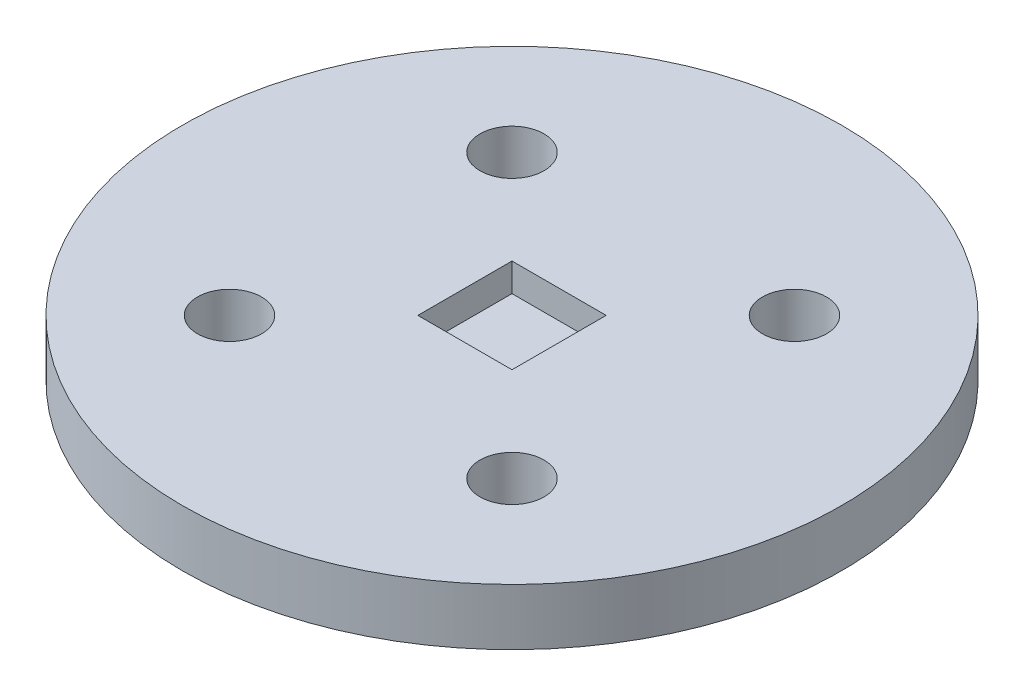
from build123d import *

# Parameters (mm, degrees)
SKETCH1_R           = 35
BOSS_EXTRUDE1_DEPTH = 6
SKETCH11_W          = 10
SKETCH11_H          = 10
CUT_EXTRUDE3_DEPTH  = 3
SKETCH12_R          = 3.4
CUT_EXTRUDE4_DEPTH  = 50.859803449
SKETCH6_W           = 6.2
SKETCH6_H           = 6.2
CUT_EXTRUDE6_DEPTH  = 1.5


with BuildPart() as part:
    # Sketch1 → Boss-Extrude1 (new body)
    with BuildSketch(Plane(origin=(0, 0, 0), x_dir=(1, 0, 0), z_dir=(0, 1, 0))):
        with Locations(Location((0, 0, 0), (0, 0, 270))):
            Circle(SKETCH1_R)
    extrude(amount=BOSS_EXTRUDE1_DEPTH)

    # Sketch11 → Cut-Extrude3 (cut)
    with BuildSketch(Plane(origin=(0, 6, 0), x_dir=(1, 0, 0), z_dir=(0, 1, 0))):
        Rectangle(SKETCH11_W, SKETCH11_H)
    extrude(amount=-CUT_EXTRUDE3_DEPTH, mode=Mode.SUBTRACT)

    # Sketch12 → Cut-Extrude4 (cut, through all)
    with BuildSketch(Plane.XZ):
        with Locations(Location((15, -15, 0), (0, 0, 270))):
            Circle(SKETCH12_R)
        with Locations(Location((-15, -15, 0), (0, 0, 270))):
            Circle(SKETCH12_R)
        with Locations(Location((15, 15, 0), (0, 0, 270))):
            Circle(SKETCH12_R)
        with Locations(Location((-15, 15, 0), (0, 0, 270))):
            Circle(SKETCH12_R)
    extrude(amount=-CUT_EXTRUDE4_DEPTH, mode=Mode.SUBTRACT)

    # Sketch6 → Cut-Extrude6 (cut)
    with BuildSketch(Plane(origin=(0, 0, -4.132474232), x_dir=(1, 0, 0), z_dir=(0, -1, 0))):
        with Locations((-23.099150513, 4.136022025)):
            Rectangle(SKETCH6_W, SKETCH6_H)
        with Locations((0.003547793, 27.231624745)):
            Rectangle(SKETCH6_W, SKETCH6_H)
        with Locations((-0.003547793, -18.966676281)):
            Rectangle(SKETCH6_W, SKETCH6_H)
        with Locations((23.099150513, 4.128926439)):
            Rectangle(SKETCH6_W, SKETCH6_H)
    extrude(amount=-CUT_EXTRUDE6_DEPTH, mode=Mode.SUBTRACT)


solid = part.part
